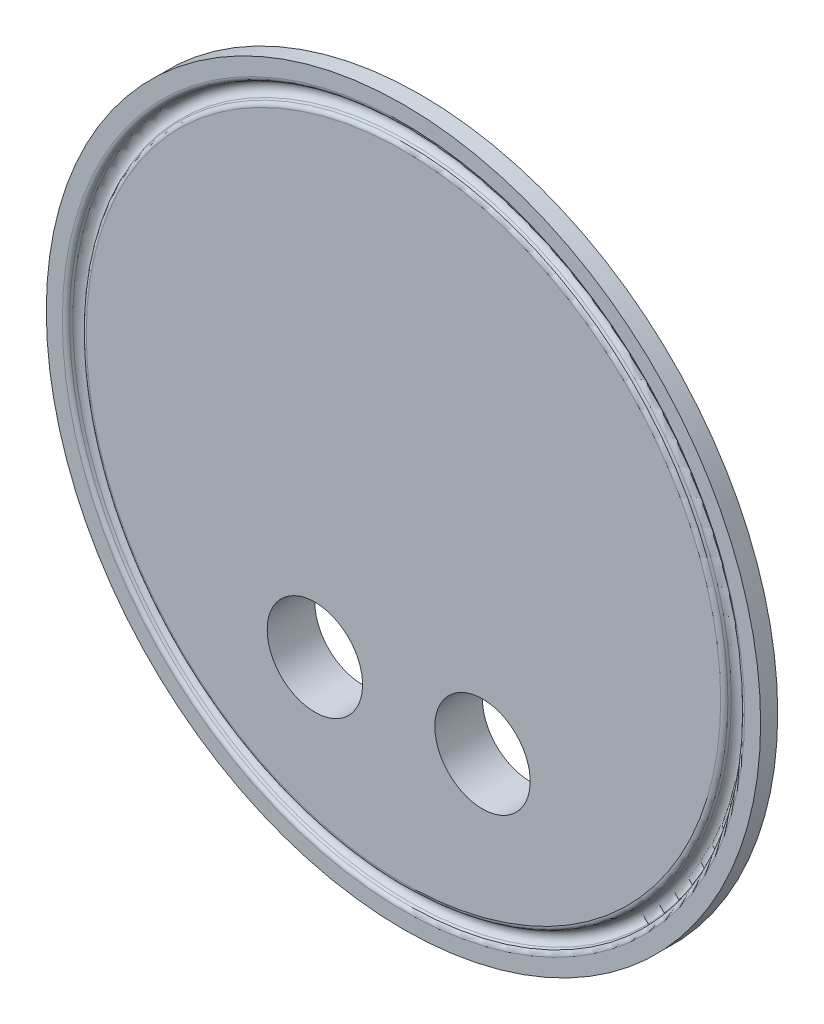
from build123d import *

# Parameters (mm, degrees)
SKETCH2_R          = 7.9375
CUT_EXTRUDE1_DEPTH = 85.463711951


with BuildPart() as part:
    # Sketch1 → Revolve1 (revolve)
    with BuildSketch(Plane(origin=(0, 0, 0), x_dir=(0, 0, -1), z_dir=(1, 0, 0)), mode=Mode.PRIVATE) as revolve1_sk:
        with BuildLine():
            Line((0, 0), (0, 52.809927725))
            ThreePointArc((0, 52.809927725), (0.130798304, 53.244522907), (0.479738309, 53.534733247))
            Line((0.479738309, 53.534733247), (0.872854821, 53.701601306))
            ThreePointArc((0.872854821, 53.701601306), (1.6002, 54.8005), (0.872854821, 55.899398694))
            Line((0.872854821, 55.899398694), (0.479738309, 56.066266753))
            ThreePointArc((0.479738309, 56.066266753), (0.130798304, 56.356477093), (0, 56.791072275))
            Line((0, 56.791072275), (0, 59.4614))
            Line((0, 59.4614), (2.8448, 59.4614))
            Line((2.8448, 59.4614), (7.9248, 45.504214709))
            Line((7.9248, 45.504214709), (7.9248, 0))
            Line((7.9248, 0), (0, 0))
        make_face()
    revolve(revolve1_sk.sketch.rotate(Axis((0, 0, 0), (0, 0, -1)), 90), axis=Axis((0, 0, 0), (0, 0, -1)))

    # Sketch2 → Cut-Extrude1 (cut, through all)
    with BuildSketch(Plane(origin=(0, 0, -7.9248), x_dir=(-1, 0, 0), z_dir=(0, 0, -1))):
        with Locations((-13.158980507, -27.586296484)):
            Circle(SKETCH2_R)
        with Locations((14.744399845, -27.586296484)):
            Circle(SKETCH2_R)
    extrude(amount=-CUT_EXTRUDE1_DEPTH, mode=Mode.SUBTRACT)


solid = part.part
